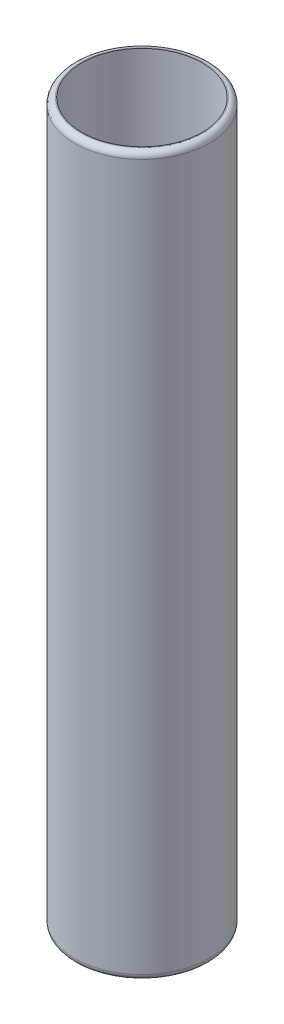
from build123d import *

# Parameters (mm, degrees)
SKETCH1_R           = 14.2875
SKETCH1_R_2         = 12.8143
BOSS_EXTRUDE1_DEPTH = 152.4
FILLET1_R           = 1.27


with BuildPart() as part:
    # Sketch1 → Boss-Extrude1 (new body)
    with BuildSketch(Plane(origin=(0, 0, 0), x_dir=(1, 0, 0), z_dir=(0, 1, 0))):
        with Locations(Location((0, 0, 0), (0, 0, 90))):
            Circle(SKETCH1_R)
        with Locations(Location((0, 0, 0), (0, 0, 90))):
            Circle(SKETCH1_R_2, mode=Mode.SUBTRACT)
    extrude(amount=BOSS_EXTRUDE1_DEPTH)

    # Fillet1
    fillet1_edges = [part.edges().sort_by_distance(p)[0] for p in [
        (0, 0, 14.2875),
        (0, 152.4, 14.2875),
    ]]
    fillet(fillet1_edges, radius=FILLET1_R)


solid = part.part
